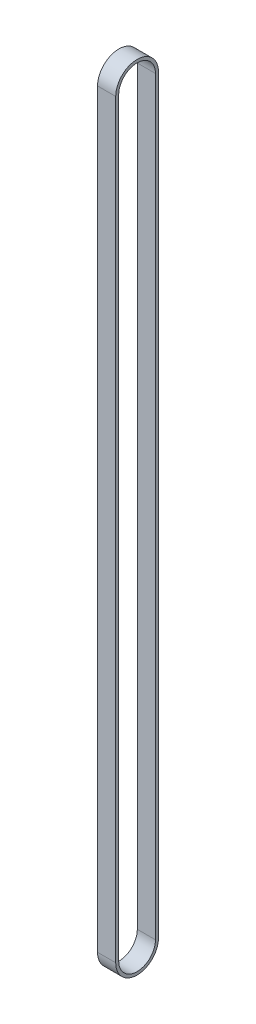
from build123d import *

# Parameters (mm, degrees)
BOSS_EXTRUDE1_DEPTH = 6.05


with BuildPart() as part:
    # Sketch1 → Boss-Extrude1 (new body)
    with BuildSketch(Plane.YZ):
        with BuildLine():
            Line((-125, 7.125), (125, 7.125))
            ThreePointArc((125, 7.125), (132.125, 0), (125, -7.125))
            Line((125, -7.125), (-125, -7.125))
            ThreePointArc((-125, -7.125), (-132.125, 0), (-125, 7.125))
        make_face()
        with BuildLine():
            Line((-125, 6.125), (125, 6.125))
            ThreePointArc((125, 6.125), (131.125, 0), (125, -6.125))
            Line((125, -6.125), (-125, -6.125))
            ThreePointArc((-125, -6.125), (-131.125, 0), (-125, 6.125))
        make_face(mode=Mode.SUBTRACT)
    extrude(amount=BOSS_EXTRUDE1_DEPTH)


solid = part.part
